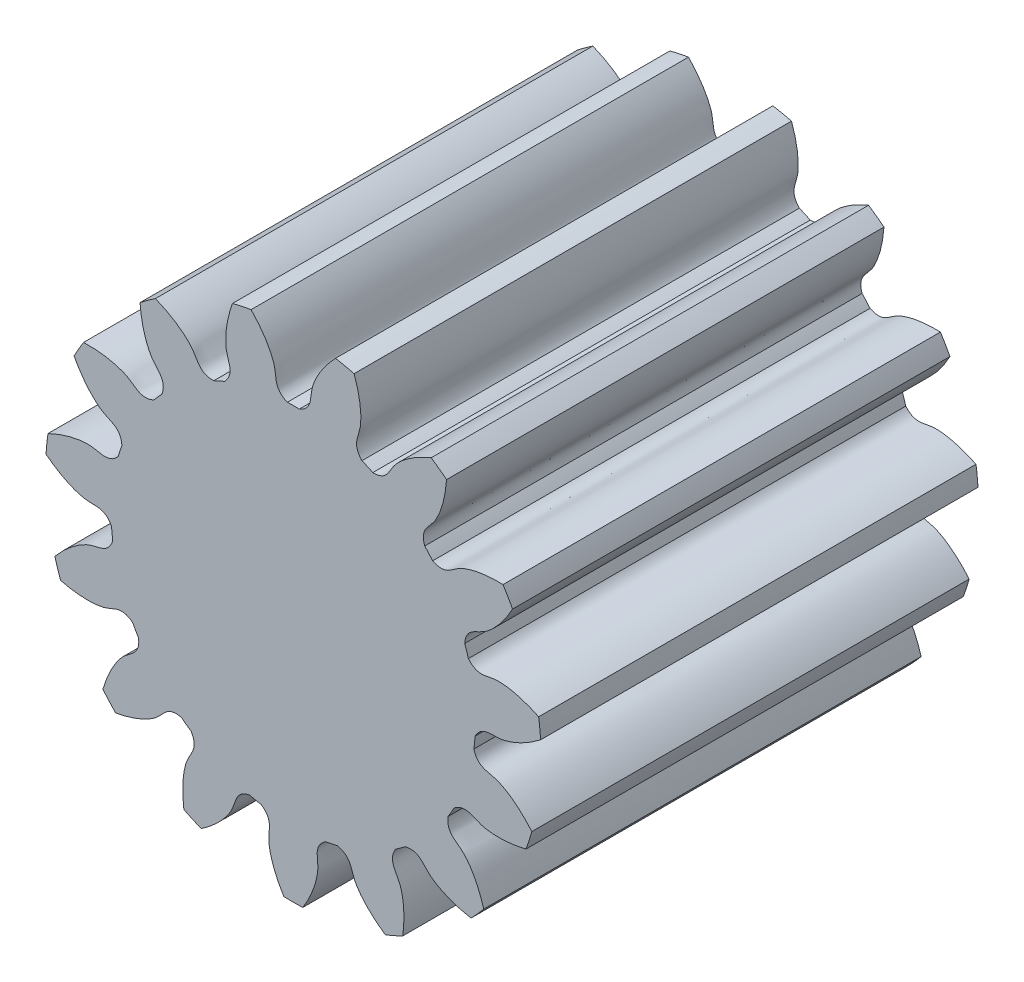
from build123d import *

# Parameters (mm, degrees)
SKETCH_1_R               = 17
EXTRUDE_1_DEPTH          = 30
CUT_EXTRUDE_1_DEPTH      = 39.444765573
PATTERN_CIRCULAR_1_COUNT = 15


with BuildPart() as part:
    # 草图1 → 凸台-拉伸1 (new body)
    with BuildSketch(Plane.XY):
        Circle(SKETCH_1_R)
    extrude(amount=EXTRUDE_1_DEPTH)

    # 草图2 → 切除-拉伸1 (cut, through all)
    with BuildSketch(Plane.XY):
        with BuildLine():
            ThreePointArc((0.408570082, 12.493321035), (0, 12.5), (-0.408570082, 12.493321035))
            add(Edge.make_bspline(
                [(-0.408570082, 12.493321035), (-1.314426117, 12.868820457), (-1.144226268, 13.572658845), (-1.302520973, 14.21700753), (-1.314866358, 14.263316593), (-1.329697695, 14.314787647), (-1.347220475, 14.371338609), (-1.367644802, 14.432879951), (-1.391176061, 14.499316195), (-1.418017606, 14.570545533), (-1.448369717, 14.646460034), (-1.482429702, 14.72694568), (-1.520391649, 14.811882453), (-1.562446298, 14.90114442), (-1.608780868, 14.994599817), (-1.659578902, 15.092111141), (-1.715020121, 15.193535247), (-1.77528026, 15.298723442), (-1.84053093, 15.407521596), (-1.910939461, 15.519770239), (-1.986668766, 15.635304677), (-2.067877193, 15.753955106), (-2.154718392, 15.875546727), (-2.247341174, 15.999899865), (-2.345889381, 16.1268301), (-2.450501754, 16.256148389), (-2.56131181, 16.387661197), (-2.678447713, 16.521170635), (-2.802032159, 16.656474594), (-2.932182257, 16.793366884), (-3.069009412, 16.931637384), (-3.212619223, 17.071072181), (-3.36311137, 17.21145372), (-3.520579511, 17.352560961), (-3.68511119, 17.494169528), (-3.856787733, 17.636051869), (-4.035684163, 17.777977411), (-4.22186911, 17.919712728), (-4.415404727, 18.0610217), (-4.616346612, 18.201665683), (-4.82474373, 18.341403675), (-5.040638346, 18.479992484), (-5.264065953, 18.617186906), (-5.495055218, 18.752739894), (-5.733627883, 18.88640274), (-6.065171324, 19.063537407), (-6.320303827, 19.190067932), (-6.493676778, 19.271856413)],
                knots=[0, 0, 0, 0, 0.202473101, 0.206978902, 0.212085478, 0.217792827, 0.224100949, 0.231009845, 0.238519514, 0.246629958, 0.255341174, 0.264653164, 0.274565928, 0.285079465, 0.296193776, 0.307908861, 0.320224719, 0.33314135, 0.346658755, 0.360776934, 0.375495886, 0.390815612, 0.406736111, 0.423257384, 0.440379431, 0.458102251, 0.476425844, 0.495350211, 0.514875352, 0.535001266, 0.555727954, 0.577055415, 0.59898365, 0.621512658, 0.64464244, 0.668372996, 0.692704325, 0.717636428, 0.743169304, 0.769302954, 0.796037377, 0.823372574, 0.851308544, 0.879845288, 0.908982806, 0.938721097, 1, 1, 1, 1], degree=3))
            ThreePointArc((-6.493676778, 19.271856413), (0, 20.336476777), (6.493676778, 19.271856413))
            add(Edge.make_bspline(
                [(0.408570082, 12.493321035), (1.314426117, 12.868820457), (1.144226268, 13.572658845), (1.302520973, 14.21700753), (1.314866358, 14.263316593), (1.329697695, 14.314787647), (1.347220475, 14.371338609), (1.367644802, 14.432879951), (1.391176061, 14.499316195), (1.418017606, 14.570545533), (1.448369717, 14.646460034), (1.482429702, 14.72694568), (1.520391649, 14.811882453), (1.562446298, 14.90114442), (1.608780868, 14.994599817), (1.659578902, 15.092111141), (1.715020121, 15.193535247), (1.77528026, 15.298723442), (1.84053093, 15.407521596), (1.910939461, 15.519770239), (1.986668766, 15.635304677), (2.067877193, 15.753955106), (2.154718392, 15.875546727), (2.247341174, 15.999899865), (2.345889381, 16.1268301), (2.450501754, 16.256148389), (2.56131181, 16.387661197), (2.678447713, 16.521170635), (2.802032159, 16.656474594), (2.932182257, 16.793366884), (3.069009412, 16.931637384), (3.212619223, 17.071072181), (3.36311137, 17.21145372), (3.520579511, 17.352560961), (3.68511119, 17.494169528), (3.856787733, 17.636051869), (4.035684163, 17.777977411), (4.22186911, 17.919712728), (4.415404727, 18.0610217), (4.616346612, 18.201665683), (4.82474373, 18.341403675), (5.040638346, 18.479992484), (5.264065953, 18.617186906), (5.495055218, 18.752739894), (5.733627883, 18.88640274), (6.065171324, 19.063537407), (6.320303827, 19.190067932), (6.493676778, 19.271856413)],
                knots=[0, 0, 0, 0, 0.202473101, 0.206978902, 0.212085478, 0.217792827, 0.224100949, 0.231009845, 0.238519514, 0.246629958, 0.255341174, 0.264653164, 0.274565928, 0.285079465, 0.296193776, 0.307908861, 0.320224719, 0.33314135, 0.346658755, 0.360776934, 0.375495886, 0.390815612, 0.406736111, 0.423257384, 0.440379431, 0.458102251, 0.476425844, 0.495350211, 0.514875352, 0.535001266, 0.555727954, 0.577055415, 0.59898365, 0.621512658, 0.64464244, 0.668372996, 0.692704325, 0.717636428, 0.743169304, 0.769302954, 0.796037377, 0.823372574, 0.851308544, 0.879845288, 0.908982806, 0.938721097, 1, 1, 1, 1], degree=3))
        make_face()
    cut_extrude_1 = extrude(amount=CUT_EXTRUDE_1_DEPTH, mode=Mode.SUBTRACT)

    # 阵列(圆周)1: 切除-拉伸1 ×15 about axis
    pattern_circular_1_axis = Axis((0, 0, -1.5), (0, 0, 1))
    for i in range(1, PATTERN_CIRCULAR_1_COUNT):
        add(cut_extrude_1.rotate(pattern_circular_1_axis, i * 360 / PATTERN_CIRCULAR_1_COUNT), mode=Mode.SUBTRACT)


solid = part.part
